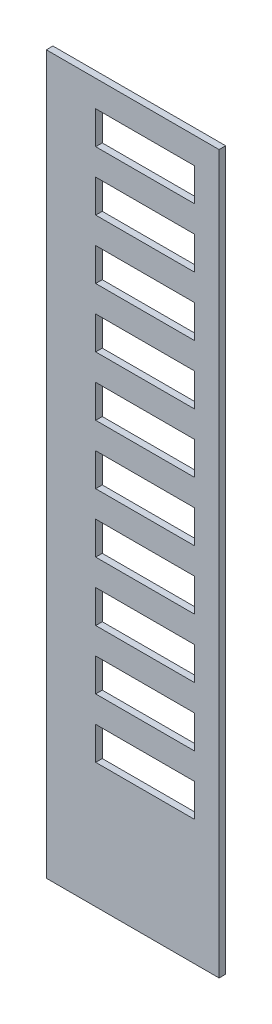
from build123d import *

# Parameters (mm, degrees)
SKETCH2_W           = 15
SKETCH2_H           = 8
SKETCH2_W_2         = 30
SKETCH2_W_3         = 7.5
SKETCH2_H_2         = 10
BOSS_EXTRUDE1_DEPTH = 2
SKETCH3_W           = 52.5
SKETCH3_H           = 30
BOSS_EXTRUDE2_DEPTH = 2


with BuildPart() as part:
    # Sketch2 → Boss-Extrude1 (new body)
    with BuildSketch(Plane.XY):
        with Locations((-15, 90)):
            Rectangle(SKETCH2_W, SKETCH2_H)
        with Locations((7.5, 90)):
            Rectangle(SKETCH2_W_2, SKETCH2_H)
        with Locations((26.25, 90)):
            Rectangle(SKETCH2_W_3, SKETCH2_H)
        with Locations((26.25, 81)):
            Rectangle(SKETCH2_W_3, SKETCH2_H_2)
        with Locations((26.25, 72)):
            Rectangle(SKETCH2_W_3, SKETCH2_H)
        with Locations((7.5, 72)):
            Rectangle(SKETCH2_W_2, SKETCH2_H)
        with Locations((-15, 72)):
            Rectangle(SKETCH2_W, SKETCH2_H)
        with Locations((-15, 81)):
            Rectangle(SKETCH2_W, SKETCH2_H_2)
        with Locations((-15, 63)):
            Rectangle(SKETCH2_W, SKETCH2_H_2)
        with Locations((-15, 54)):
            Rectangle(SKETCH2_W, SKETCH2_H)
        with Locations((7.5, 54)):
            Rectangle(SKETCH2_W_2, SKETCH2_H)
        with Locations((26.25, 54)):
            Rectangle(SKETCH2_W_3, SKETCH2_H)
        with Locations((26.25, 63)):
            Rectangle(SKETCH2_W_3, SKETCH2_H_2)
        with Locations((-15, 45)):
            Rectangle(SKETCH2_W, SKETCH2_H_2)
        with Locations((-15, 36)):
            Rectangle(SKETCH2_W, SKETCH2_H)
        with Locations((-15, 27)):
            Rectangle(SKETCH2_W, SKETCH2_H_2)
        with Locations((-15, -90)):
            Rectangle(SKETCH2_W, SKETCH2_H)
        with Locations((7.5, -90)):
            Rectangle(SKETCH2_W_2, SKETCH2_H)
        with Locations((26.25, -90)):
            Rectangle(SKETCH2_W_3, SKETCH2_H)
        with Locations((26.25, -81)):
            Rectangle(SKETCH2_W_3, SKETCH2_H_2)
        with Locations((-15, -81)):
            Rectangle(SKETCH2_W, SKETCH2_H_2)
        with Locations((-15, -72)):
            Rectangle(SKETCH2_W, SKETCH2_H)
        with Locations((7.5, -72)):
            Rectangle(SKETCH2_W_2, SKETCH2_H)
        with Locations((26.25, -72)):
            Rectangle(SKETCH2_W_3, SKETCH2_H)
        with Locations((26.25, -63)):
            Rectangle(SKETCH2_W_3, SKETCH2_H_2)
        with Locations((26.25, -54)):
            Rectangle(SKETCH2_W_3, SKETCH2_H)
        with Locations((7.5, -54)):
            Rectangle(SKETCH2_W_2, SKETCH2_H)
        with Locations((-15, -54)):
            Rectangle(SKETCH2_W, SKETCH2_H)
        with Locations((-15, -63)):
            Rectangle(SKETCH2_W, SKETCH2_H_2)
        with Locations((-15, -45)):
            Rectangle(SKETCH2_W, SKETCH2_H_2)
        with Locations((-15, -36)):
            Rectangle(SKETCH2_W, SKETCH2_H)
        with Locations((-15, -27)):
            Rectangle(SKETCH2_W, SKETCH2_H_2)
        with Locations((-15, -18)):
            Rectangle(SKETCH2_W, SKETCH2_H)
        with Locations((-15, -9)):
            Rectangle(SKETCH2_W, SKETCH2_H_2)
        with Locations((7.5, -36)):
            Rectangle(SKETCH2_W_2, SKETCH2_H)
        with Locations((26.25, -36)):
            Rectangle(SKETCH2_W_3, SKETCH2_H)
        with Locations((26.25, -45)):
            Rectangle(SKETCH2_W_3, SKETCH2_H_2)
        with Locations((26.25, -27)):
            Rectangle(SKETCH2_W_3, SKETCH2_H_2)
        with Locations((26.25, -18)):
            Rectangle(SKETCH2_W_3, SKETCH2_H)
        with Locations((7.5, -18)):
            Rectangle(SKETCH2_W_2, SKETCH2_H)
        with Locations((26.25, -9)):
            Rectangle(SKETCH2_W_3, SKETCH2_H_2)
        with Locations((-15, 0)):
            Rectangle(SKETCH2_W, SKETCH2_H)
        with Locations((7.5, 0)):
            Rectangle(SKETCH2_W_2, SKETCH2_H)
        with Locations((26.25, 0)):
            Rectangle(SKETCH2_W_3, SKETCH2_H)
        with Locations((26.25, 9)):
            Rectangle(SKETCH2_W_3, SKETCH2_H_2)
        with Locations((-15, 9)):
            Rectangle(SKETCH2_W, SKETCH2_H_2)
        with Locations((-15, 18)):
            Rectangle(SKETCH2_W, SKETCH2_H)
        with Locations((7.5, 36)):
            Rectangle(SKETCH2_W_2, SKETCH2_H)
        with Locations((7.5, 18)):
            Rectangle(SKETCH2_W_2, SKETCH2_H)
        with Locations((26.25, 18)):
            Rectangle(SKETCH2_W_3, SKETCH2_H)
        with Locations((26.25, 27)):
            Rectangle(SKETCH2_W_3, SKETCH2_H_2)
        with Locations((26.25, 36)):
            Rectangle(SKETCH2_W_3, SKETCH2_H)
        with Locations((26.25, 45)):
            Rectangle(SKETCH2_W_3, SKETCH2_H_2)
    extrude(amount=BOSS_EXTRUDE1_DEPTH)

    # Sketch3 → Boss-Extrude2 (add)
    with BuildSketch(Plane.XY.offset(2)):
        with Locations((3.75, -109)):
            Rectangle(SKETCH3_W, SKETCH3_H)
    extrude(amount=-BOSS_EXTRUDE2_DEPTH)


solid = part.part
